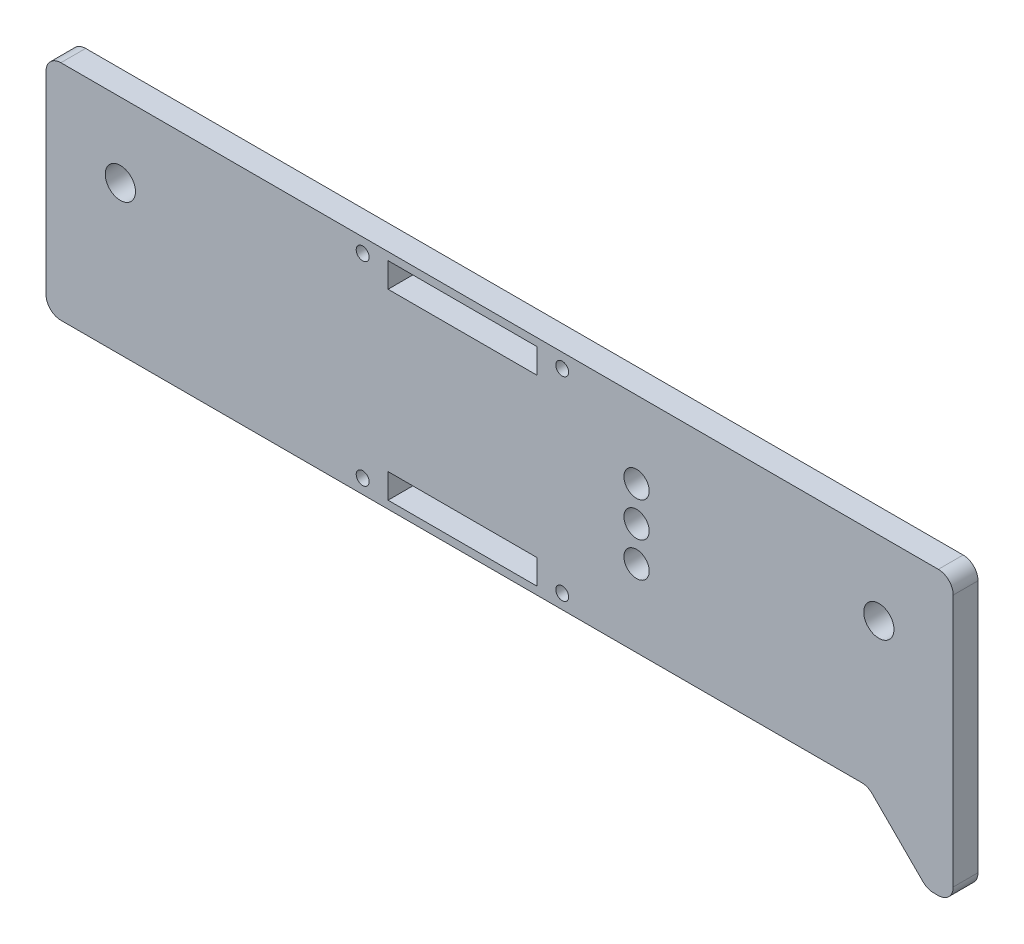
from build123d import *

# Parameters (mm, degrees)
SKETCH1_R           = 3.05
SKETCH1_R_2         = 2.55
SKETCH1_R_3         = 1.3
SKETCH1_W           = 30
SKETCH1_H           = 5
BOSS_EXTRUDE1_DEPTH = 5
FILLET1_R           = 3


with BuildPart() as part:
    # Sketch1 → Boss-Extrude1 (new body)
    with BuildSketch(Plane.XY):
        Polygon((183, -12), (183, 45), (0, 45), (0, 0), (165.78, 0), (177.78, -12), align=None)
        with Locations((15, 30)):
            Circle(SKETCH1_R, mode=Mode.SUBTRACT)
        with Locations((168, 30)):
            Circle(SKETCH1_R, mode=Mode.SUBTRACT)
        with Locations((119.125, 29.5)):
            Circle(SKETCH1_R_2, mode=Mode.SUBTRACT)
        with Locations((119.125, 22.5)):
            Circle(SKETCH1_R_2, mode=Mode.SUBTRACT)
        with Locations((119.125, 15.5)):
            Circle(SKETCH1_R_2, mode=Mode.SUBTRACT)
        with Locations((63.875, 42.125)):
            Circle(SKETCH1_R_3, mode=Mode.SUBTRACT)
        with Locations((104.125, 42.125)):
            Circle(SKETCH1_R_3, mode=Mode.SUBTRACT)
        with Locations((104.125, 2.875)):
            Circle(SKETCH1_R_3, mode=Mode.SUBTRACT)
        with Locations((63.875, 2.875)):
            Circle(SKETCH1_R_3, mode=Mode.SUBTRACT)
        with Locations((84, 40.925)):
            Rectangle(SKETCH1_W, SKETCH1_H, mode=Mode.SUBTRACT)
        with Locations((84, 4.075)):
            Rectangle(SKETCH1_W, SKETCH1_H, mode=Mode.SUBTRACT)
    extrude(amount=BOSS_EXTRUDE1_DEPTH)

    # Fillet1
    fillet1_edges = [part.edges().sort_by_distance(p)[0] for p in [
        (0, 0, 2.5),
        (0, 45, 2.5),
        (183, 45, 2.5),
        (183, -12, 2.5),
        (177.78, -12, 2.5),
        (165.78, 0, 2.5),
    ]]
    fillet(fillet1_edges, radius=FILLET1_R)


solid = part.part
